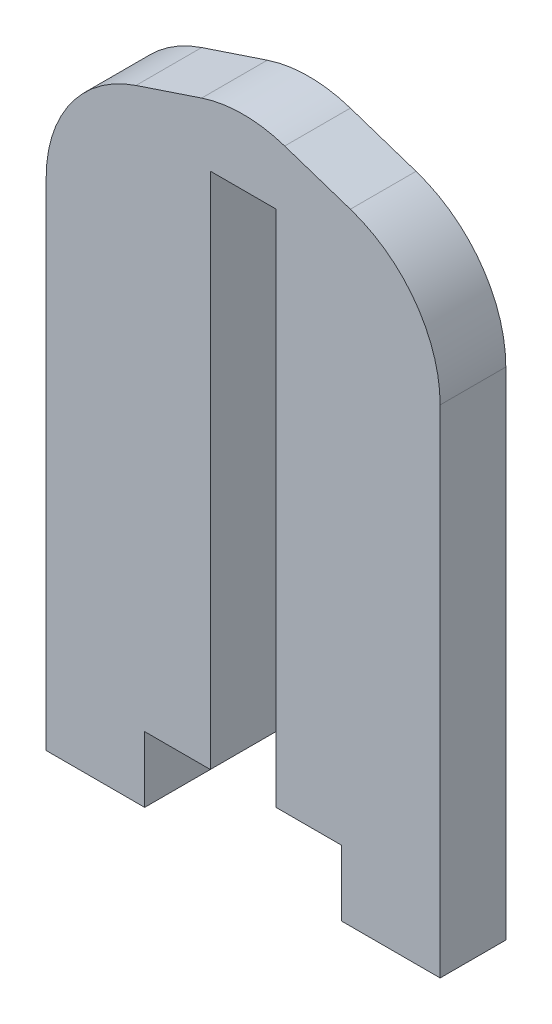
from build123d import *

# Parameters (mm, degrees)
BOSS_EXTRUDE1_DEPTH     = 6.35
FILLET1_R               = 12.7
CUT_EXTRUDE1_DEPTH      = 44.067795393
CUT_EXTRUDE1_DEPTH_BACK = 44.067795393
SKETCH2_W               = 6.35
SKETCH2_H               = 50.113024572


with BuildPart() as part:
    # Sketch1 → Boss-Extrude1 (new body)
    with BuildSketch(Plane.XY):
        Polygon((-9.525, -31.75), (9.525, -31.75), (9.525, -38.1), (19.05, -38.1), (19.05, -31.75), (19.05, 19.05), (0, 25.4), (-19.05, 19.05), (-19.05, -31.75), (-19.05, -38.1), (-9.525, -38.1), align=None)
    extrude(amount=BOSS_EXTRUDE1_DEPTH)

    # Fillet1
    fillet1_edges = [part.edges().sort_by_distance(p)[0] for p in [
        (-19.05, 19.05, 3.175),
        (0, 25.4, 3.175),
        (19.05, 19.05, 3.175),
    ]]
    fillet(fillet1_edges, radius=FILLET1_R)

    # Sketch2 → Cut-Extrude1 (cut, two sides: drawn at the far end of the back side and taken through both)
    with BuildSketch(Plane.XY.offset(6.35).offset(-CUT_EXTRUDE1_DEPTH_BACK)):
        with Locations((0, -6.693487714)):
            Rectangle(SKETCH2_W, SKETCH2_H)
    extrude(amount=CUT_EXTRUDE1_DEPTH + CUT_EXTRUDE1_DEPTH_BACK, mode=Mode.SUBTRACT)


solid = part.part
